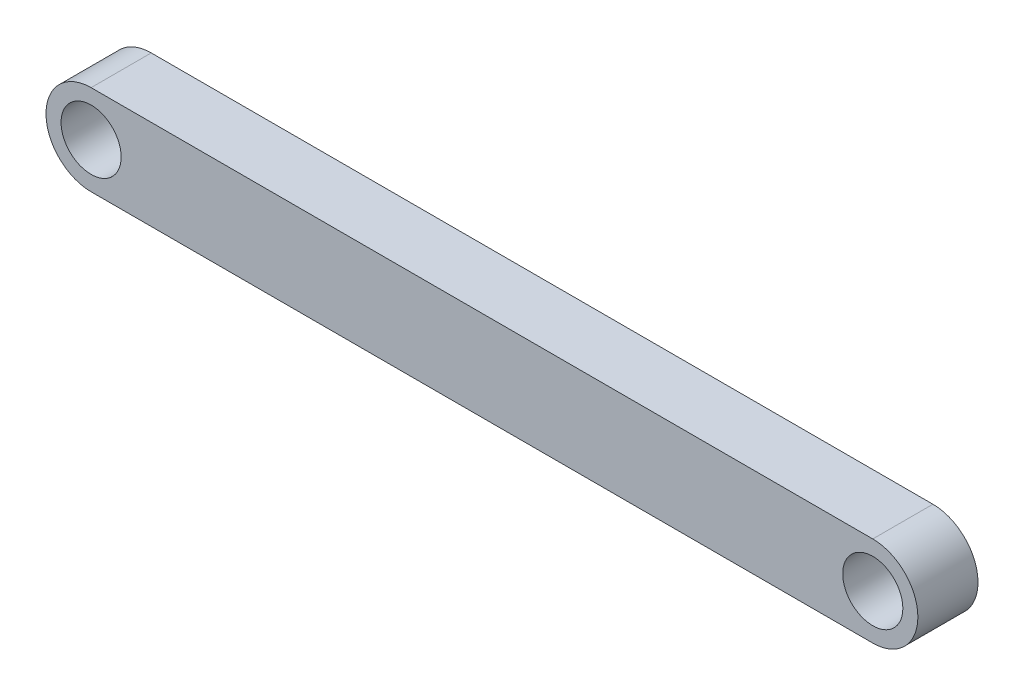
from build123d import *

# Parameters (mm, degrees)
SKETCH2_R           = 3.175
BOSS_EXTRUDE1_DEPTH = 6.35


with BuildPart() as part:
    # Sketch2 → Boss-Extrude1 (new body)
    with BuildSketch(Plane.XY):
        with BuildLine():
            Line((0, 4.7625), (82.55, 4.7625))
            ThreePointArc((82.55, 4.7625), (87.3125, 0), (82.55, -4.7625))
            Line((82.55, -4.7625), (0, -4.7625))
            ThreePointArc((0, -4.7625), (-4.7625, 0), (0, 4.7625))
        make_face()
        with Locations((82.55, 0)):
            Circle(SKETCH2_R, mode=Mode.SUBTRACT)
        Circle(SKETCH2_R, mode=Mode.SUBTRACT)
    extrude(amount=BOSS_EXTRUDE1_DEPTH)


solid = part.part
